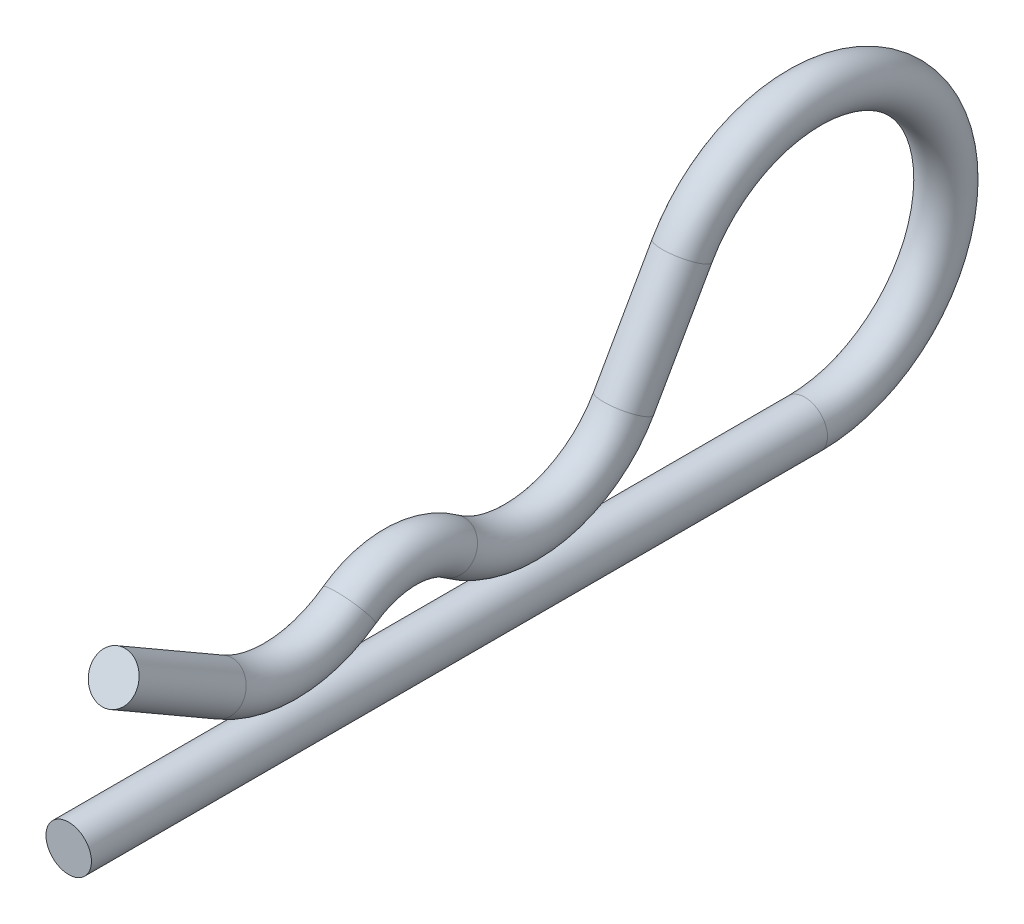
from build123d import *

# Parameters (mm, degrees)
SKETCH2_R = 1.524


with BuildPart() as part:
    # Sweep1: sweep along a path in Sketch3
    with BuildLine(Plane(origin=(0, 0, 0), x_dir=(0, 0, -1), z_dir=(1, 0, 0))) as sweep1_path:
        Line((-21.6535, 8.406847067), (-14.477572438, 4.263823357))
        ThreePointArc((-14.477572438, 4.263823357), (-10.099954916, 3.210937555), (-5.853894392, 4.708627014))
        ThreePointArc((-5.853894392, 4.708627014), (-2.44475, 5.813212007), (0.964394392, 4.708627014))
        ThreePointArc((0.964394392, 4.708627014), (7.306395665, 3.381761129), (12.52424514, 7.223063001))
        Line((12.52424514, 7.223063001), (16.439082139, 14.127985703))
        ThreePointArc((16.439082139, 14.127985703), (32.845076805, 14.22427376), (24.66975, 0))
        Line((24.66975, 0), (-24.66975, 0))
    # Sketch2 → Sweep1 (sweep)
    with BuildSketch(Plane.XY.offset(24.66975)):
        Circle(SKETCH2_R)
    sweep(path=sweep1_path.line)


solid = part.part
